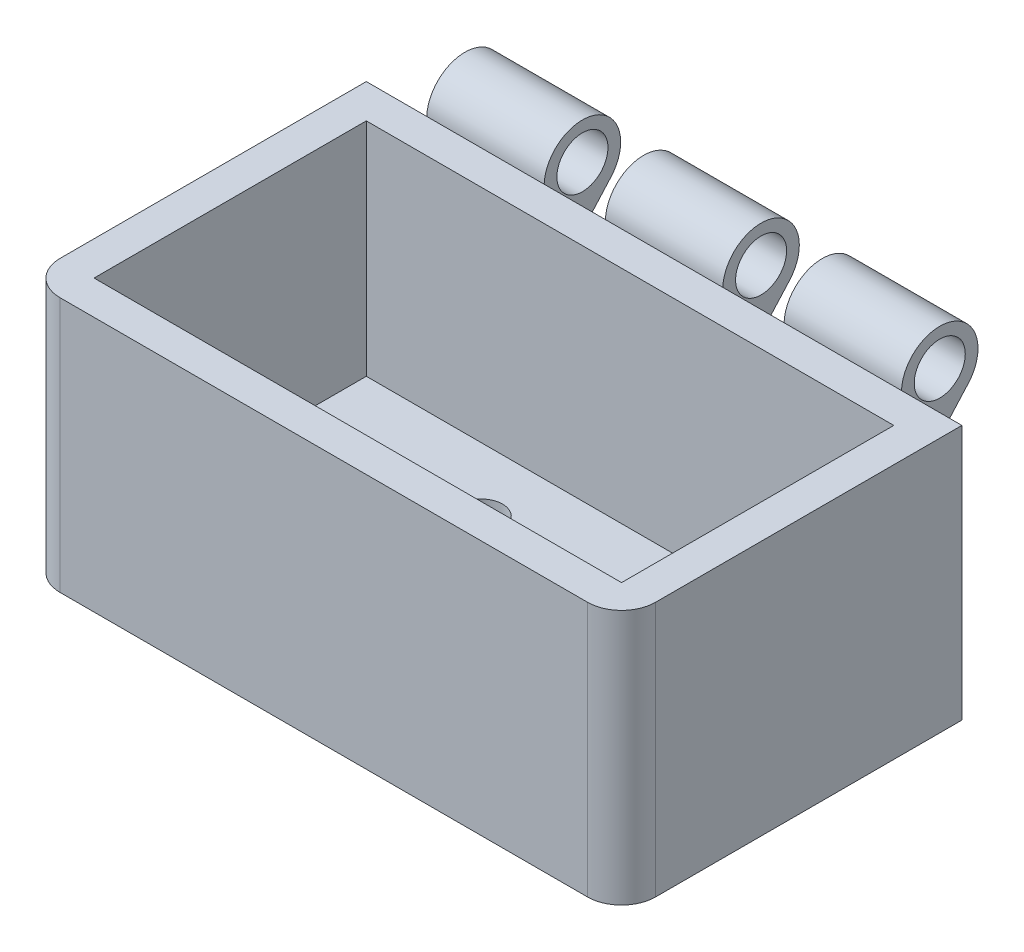
from build123d import *

# Parameters (mm, degrees)
SKETCH1_W           = 35
SKETCH1_H           = 20
BOSS_EXTRUDE4_DEPTH = 15
SHELL2_T            = -2
SKETCH8_R           = 1.5
BOSS_EXTRUDE7_DEPTH = 6.9
LPATTERN4_COUNT     = 3
LPATTERN4_PITCH     = 10.5
FILLET1_R           = 2
CUT_EXTRUDE2_START  = -5
SKETCH9_R           = 1.25
CUT_EXTRUDE2_DEPTH  = 34.469380611
SKETCH10_R          = 1.25
CUT_EXTRUDE3_DEPTH  = 28.311380776


with BuildPart() as part:
    # Sketch1 → Boss-Extrude4 (new body)
    with BuildSketch(Plane(origin=(0, 0, 0), x_dir=(1, 0, 0), z_dir=(0, 1, 0))):
        Rectangle(SKETCH1_W, SKETCH1_H)
    extrude(amount=BOSS_EXTRUDE4_DEPTH)

    # Shell2
    shell2_openings = [part.faces().sort_by_distance(p)[0] for p in [
        (0, 15, 0),
    ]]
    offset(amount=SHELL2_T, openings=shell2_openings, kind=Kind.INTERSECTION)

    # Sketch8 → Boss-Extrude7 (add)
    with BuildSketch(Plane(origin=(13.95, 0, 0), x_dir=(0, 0, -1), z_dir=(1, 0, 0))):
        with BuildLine():
            Line((13.926543174, 13.400522246), (10, 9))
            Line((10, 9), (10, 15))
            ThreePointArc((10, 15), (13.096526294, 16.982277643), (13.926543174, 13.400522246))
        make_face()
        with Locations((12.249990037, 14.993304126)):
            Circle(SKETCH8_R, mode=Mode.SUBTRACT)
    boss_extrude7 = extrude(amount=-BOSS_EXTRUDE7_DEPTH)

    # LPattern4: Boss-Extrude7 ×3
    with Locations(*[(-i * LPATTERN4_PITCH, 0, 0) for i in range(1, LPATTERN4_COUNT)]):
        add(boss_extrude7)

    # Fillet1
    fillet1_edges = [part.edges().sort_by_distance(p)[0] for p in [
        (17.5, 7.5, 10),
        (-17.5, 7.5, 10),
    ]]
    fillet(fillet1_edges, radius=FILLET1_R)

    # Sketch9 → Cut-Extrude2 (cut)
    with BuildSketch(Plane(origin=(0, 0, 0), x_dir=(1, 0, 0), z_dir=(0, 1, 0)).offset(CUT_EXTRUDE2_START)):
        with Locations(Location((-4.997517741, 4.250548665, 0), (0, 0, 90))):
            Circle(SKETCH9_R)
    cut_extrude2 = extrude(amount=CUT_EXTRUDE2_DEPTH, mode=Mode.SUBTRACT)

    # Sketch10 → Cut-Extrude3 (cut, through all)
    with BuildSketch(Plane(origin=(0, 2, 0), x_dir=(1, 0, 0), z_dir=(0, 1, 0))):
        with Locations(Location((-5.055245898, -0.559104904, 0), (0, 0, 270))):
            Circle(SKETCH10_R)
    cut_extrude3 = extrude(amount=-CUT_EXTRUDE3_DEPTH, mode=Mode.SUBTRACT)

    # Mirror1: Cut-Extrude2, Cut-Extrude3 across plane
    add(cut_extrude2.mirror(Plane(origin=(0, 0, 0), x_dir=(0, 0, 1), z_dir=(1, 0, 0))), mode=Mode.SUBTRACT)
    add(cut_extrude3.mirror(Plane(origin=(0, 0, 0), x_dir=(0, 0, 1), z_dir=(1, 0, 0))), mode=Mode.SUBTRACT)


solid = part.part
